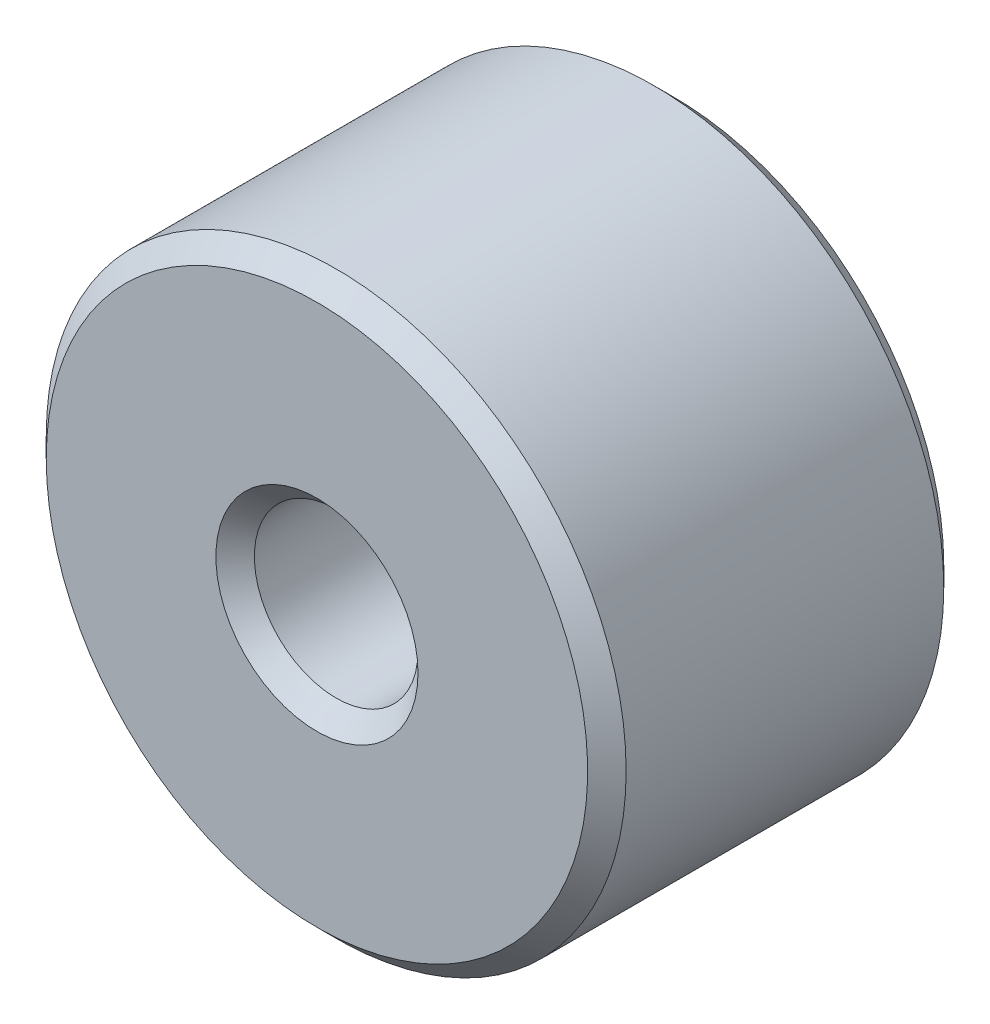
from build123d import *

# Parameters (mm, degrees)
SKETCH1_R           = 6.025
SKETCH1_R_2         = 1.7
BOSS_EXTRUDE1_DEPTH = 7.4
CHAMFER1_SIZE       = 0.4


with BuildPart() as part:
    # Sketch1 → Boss-Extrude1 (new body)
    with BuildSketch(Plane.XY):
        Circle(SKETCH1_R)
        Circle(SKETCH1_R_2, mode=Mode.SUBTRACT)
    extrude(amount=BOSS_EXTRUDE1_DEPTH)

    # Chamfer1
    chamfer1_edges = [part.edges().sort_by_distance(p)[0] for p in [
        (-6.025, 0, 0),
        (-6.025, 0, 7.4),
        (-1.7, 0, 0),
        (-1.7, 0, 7.4),
    ]]
    chamfer(chamfer1_edges, length=CHAMFER1_SIZE)


solid = part.part
